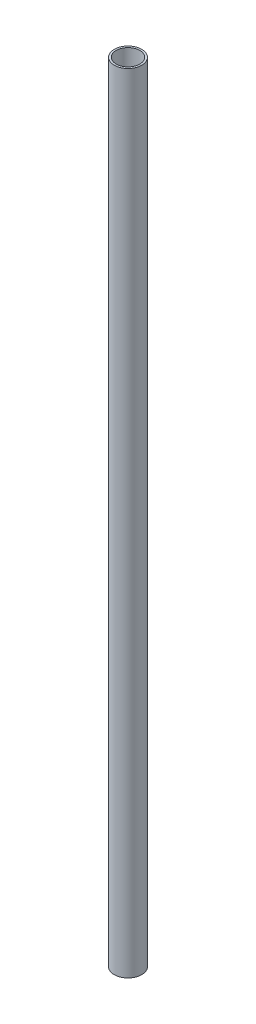
from build123d import *

# Parameters (mm, degrees)
SKETCH1_R           = 11.5
SKETCH1_R_2         = 9.9
BOSS_EXTRUDE1_DEPTH = 658


with BuildPart() as part:
    # Sketch1 → Boss-Extrude1 (new body)
    with BuildSketch(Plane(origin=(0, 0, 0), x_dir=(1, 0, 0), z_dir=(0, 1, 0))):
        with Locations(Location((0, 0, 0), (0, 0, 270))):
            Circle(SKETCH1_R)
        with Locations(Location((0, 0, 0), (0, 0, 270))):
            Circle(SKETCH1_R_2, mode=Mode.SUBTRACT)
    extrude(amount=BOSS_EXTRUDE1_DEPTH)


solid = part.part
